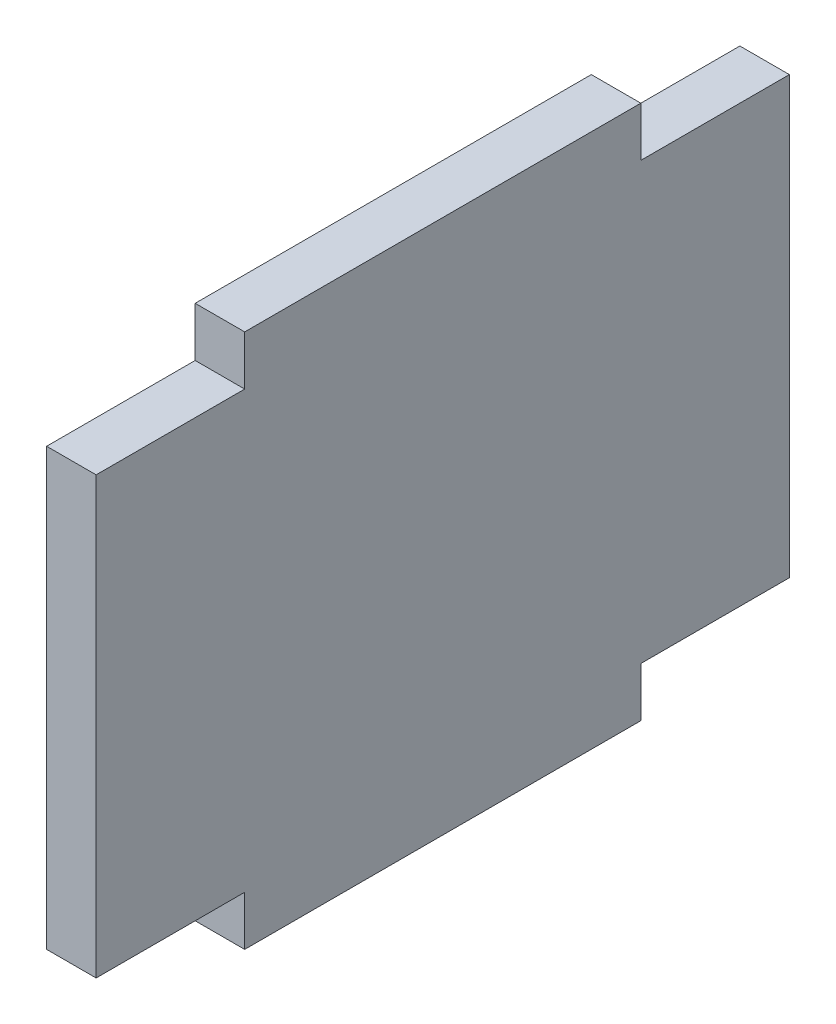
from build123d import *

# Parameters (mm, degrees)
BOSS_EXTRUDE1_DEPTH = 1.25


with BuildPart() as part:
    # Sketch1 → Boss-Extrude1 (new, symmetric)
    with BuildSketch(Plane(origin=(0, 0, 0), x_dir=(0, 0, -1), z_dir=(1, 0, 0))):
        Polygon((-17.5, -11), (-17.5, 11), (-10, 11), (-10, 13.5), (10, 13.5), (10, 11), (17.5, 11), (17.5, -11), (10, -11), (10, -13.5), (-10, -13.5), (-10, -11), align=None)
    extrude(amount=BOSS_EXTRUDE1_DEPTH, both=True)


solid = part.part
